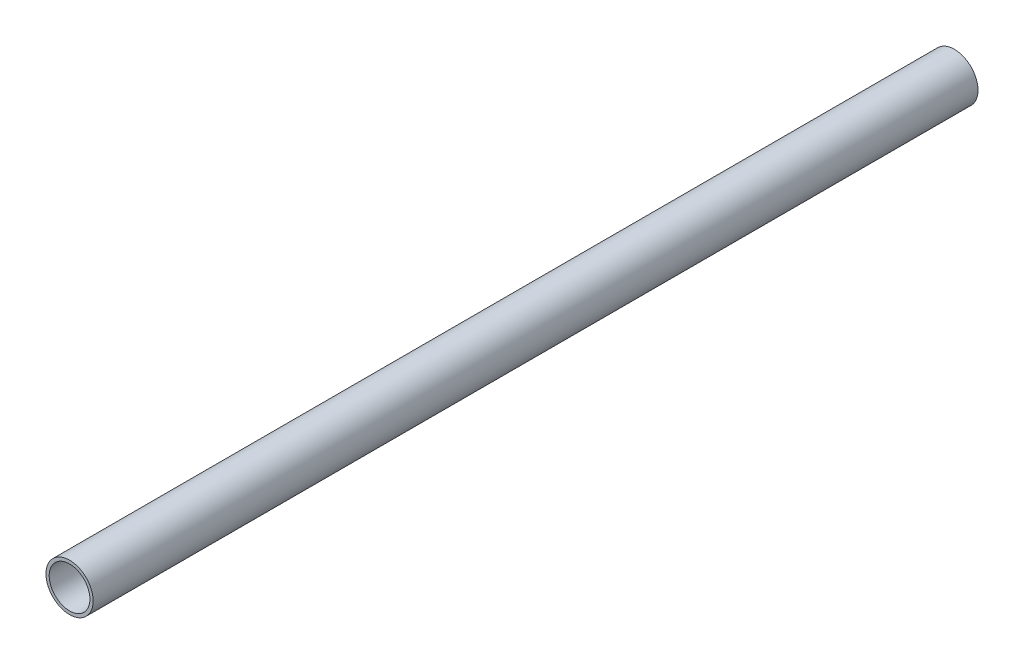
from build123d import *

# Parameters (mm, degrees)
SKETCH1_R           = 8
SKETCH1_R_2         = 6.9
BOSS_EXTRUDE1_DEPTH = 300


with BuildPart() as part:
    # Sketch1 → Boss-Extrude1 (new body)
    with BuildSketch(Plane.XY):
        Circle(SKETCH1_R)
        Circle(SKETCH1_R_2, mode=Mode.SUBTRACT)
    extrude(amount=BOSS_EXTRUDE1_DEPTH)


solid = part.part
